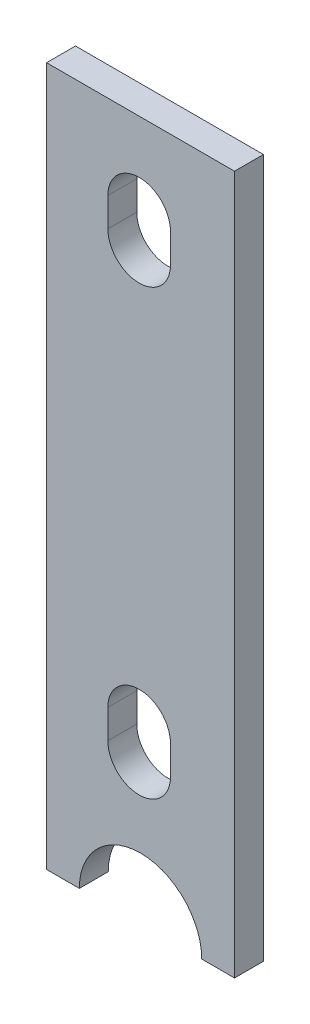
from build123d import *

# Parameters (mm, degrees)
SKETCH1_W           = 39
SKETCH1_H           = 145
BOSS_EXTRUDE1_DEPTH = 6
CUT_EXTRUDE2_DEPTH  = 6
CUT_EXTRUDE3_DEPTH  = 10


with BuildPart() as part:
    # Sketch1 → Boss-Extrude1 (new body)
    with BuildSketch(Plane.XY):
        with Locations((19.5, -72.5)):
            Rectangle(SKETCH1_W, SKETCH1_H)
    extrude(amount=BOSS_EXTRUDE1_DEPTH)

    # Sketch4 → Cut-Extrude2 (cut)
    with BuildSketch(Plane.XY.offset(6)):
        with BuildLine():
            Line((25.717260001, -109.5), (25.717260001, -115.5))
            ThreePointArc((25.717260001, -115.5), (19.217260001, -122), (12.717260001, -115.5))
            Line((12.717260001, -115.5), (12.717260001, -109.5))
            ThreePointArc((12.717260001, -109.5), (19.217260001, -103), (25.717260001, -109.5))
        make_face()
        with BuildLine():
            Line((25.717260001, -23.5), (25.717260001, -17.5))
            ThreePointArc((25.717260001, -17.5), (19.217260001, -11), (12.717260001, -17.5))
            Line((12.717260001, -17.5), (12.717260001, -23.5))
            ThreePointArc((12.717260001, -23.5), (19.217260001, -30), (25.717260001, -23.5))
        make_face()
    extrude(amount=-CUT_EXTRUDE2_DEPTH, mode=Mode.SUBTRACT)

    # Sketch5 → Cut-Extrude3 (cut)
    with BuildSketch(Plane.XY.offset(6)):
        with BuildLine():
            Line((6.8, -145), (32.2, -145))
            ThreePointArc((32.2, -145), (19.5, -132.3), (6.8, -145))
        make_face()
    extrude(amount=-CUT_EXTRUDE3_DEPTH, mode=Mode.SUBTRACT)


solid = part.part
